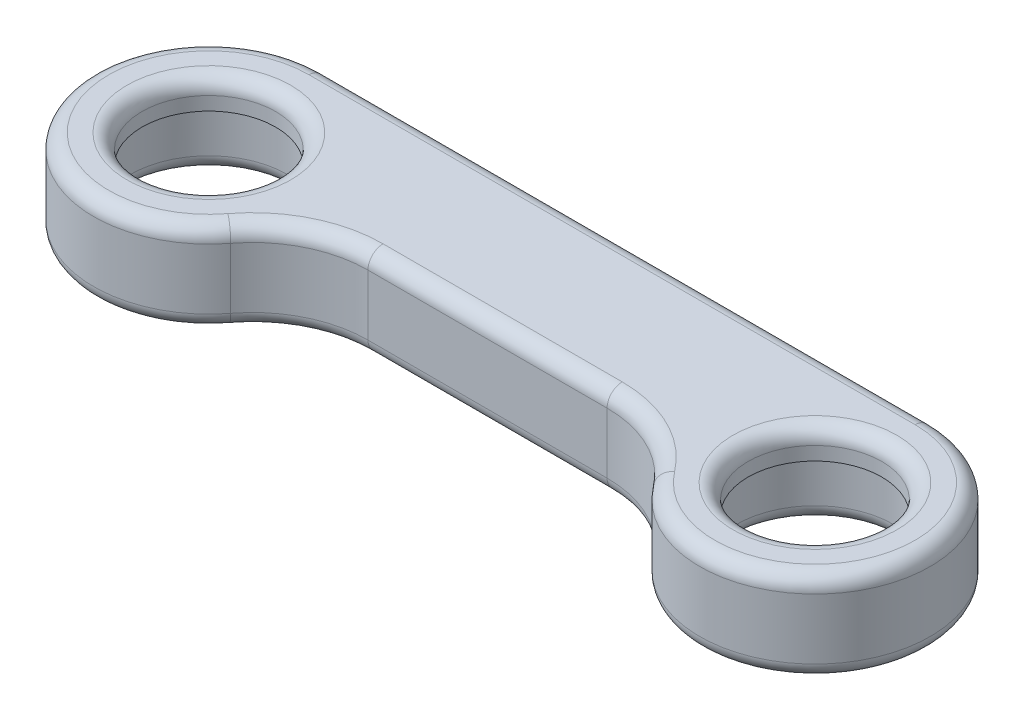
from build123d import *

# Parameters (mm, degrees)
SKETCH1_R           = 4.125
BOSS_EXTRUDE1_DEPTH = 4.5
SKETCH2_R           = 3.5
BOSS_EXTRUDE2_DEPTH = 1.5
CUT_EXTRUDE1_DEPTH  = 1.2375
CUT_EXTRUDE2_DEPTH  = 24.22563737
FILLET2_R           = 0.79375
FILLET3_R           = 0.79375


with BuildPart() as part:
    # Sketch1 → Boss-Extrude1 (new body)
    with BuildSketch(Plane(origin=(0, 0, 0), x_dir=(1, 0, 0), z_dir=(0, 1, 0))):
        with BuildLine():
            Line((-15.875, 6.04), (15.875, 6.04))
            ThreePointArc((15.875, 6.04), (21.915, 0), (15.875, -6.04))
            Line((15.875, -6.04), (-15.875, -6.04))
            ThreePointArc((-15.875, -6.04), (-21.915, 0), (-15.875, 6.04))
        make_face()
        with Locations(Location((-15.875, 0, 0), (0, 0, 270))):
            Circle(SKETCH1_R, mode=Mode.SUBTRACT)
        with Locations(Location((15.875, 0, 0), (0, 0, 270))):
            Circle(SKETCH1_R, mode=Mode.SUBTRACT)
    extrude(amount=BOSS_EXTRUDE1_DEPTH)

    # Sketch2 → Boss-Extrude2 (add)
    with BuildSketch(Plane(origin=(0, 4.5, 0), x_dir=(1, 0, 0), z_dir=(0, 1, 0))):
        with BuildLine():
            Line((-15.875, -6.04), (15.875, -6.04))
            ThreePointArc((15.875, -6.04), (21.915, 0), (15.875, 6.04))
            Line((15.875, 6.04), (-15.875, 6.04))
            ThreePointArc((-15.875, 6.04), (-21.915, 0), (-15.875, -6.04))
        make_face()
        with Locations(Location((-15.875, 0, 0), (0, 0, 90))):
            Circle(SKETCH2_R, mode=Mode.SUBTRACT)
        with Locations(Location((15.875, 0, 0), (0, 0, 90))):
            Circle(SKETCH2_R, mode=Mode.SUBTRACT)
    extrude(amount=BOSS_EXTRUDE2_DEPTH)

    # Sketch3 → Cut-Extrude1 (cut)
    with BuildSketch(Plane.XZ):
        with BuildLine():
            Line((15.875, 6.04), (-15.875, 6.04))
            ThreePointArc((-15.875, 6.04), (-21.915, 0), (-15.875, -6.04))
            Line((-15.875, -6.04), (15.875, -6.04))
            ThreePointArc((15.875, -6.04), (21.915, 0), (15.875, 6.04))
        make_face()
    extrude(amount=-CUT_EXTRUDE1_DEPTH, mode=Mode.SUBTRACT)

    # Sketch4 → Cut-Extrude2 (cut, through all)
    with BuildSketch(Plane(origin=(0, 6, 0), x_dir=(1, 0, 0), z_dir=(0, 1, 0))):
        with BuildLine():
            Line((-6.263517609, -1.2775), (6.263517609, -1.2775))
            ThreePointArc((6.263517609, -1.2775), (8.945191527, -1.905455562), (11.069258805, -3.65875))
            ThreePointArc((11.069258805, -3.65875), (13.193326082, -5.412044438), (15.875, -6.04))
            Line((15.875, -6.04), (-15.875, -6.04))
            ThreePointArc((-15.875, -6.04), (-13.193326082, -5.412044438), (-11.069258805, -3.65875))
            ThreePointArc((-11.069258805, -3.65875), (-8.945191527, -1.905455562), (-6.263517609, -1.2775))
        make_face()
    extrude(amount=-CUT_EXTRUDE2_DEPTH, mode=Mode.SUBTRACT)

    # Fillet2
    fillet2_edges = [part.edges().sort_by_distance(p)[0] for p in [
        (-15.875, 1.2375, -4.125),
        (15.875, 1.2375, -4.125),
        (21.915, 1.2375, 0),
        (0, 1.2375, -6.04),
        (-21.287044438, 1.2375, 2.681673918),
        (-8.945191527, 1.2375, 1.905455562),
        (0, 1.2375, 1.2775),
        (8.945191527, 1.2375, 1.905455562),
    ]]
    fillet(fillet2_edges, radius=FILLET2_R)

    # Fillet3
    fillet3_edges = [part.edges().sort_by_distance(p)[0] for p in [
        (-21.287044438, 6, 2.681673918),
        (21.915, 6, 0),
        (0, 6, -6.04),
        (15.875, 6, 3.5),
        (-15.875, 6, 3.5),
        (8.945191527, 6, 1.905455562),
        (0, 6, 1.2775),
        (-8.945191527, 6, 1.905455562),
    ]]
    fillet(fillet3_edges, radius=FILLET3_R)


solid = part.part
